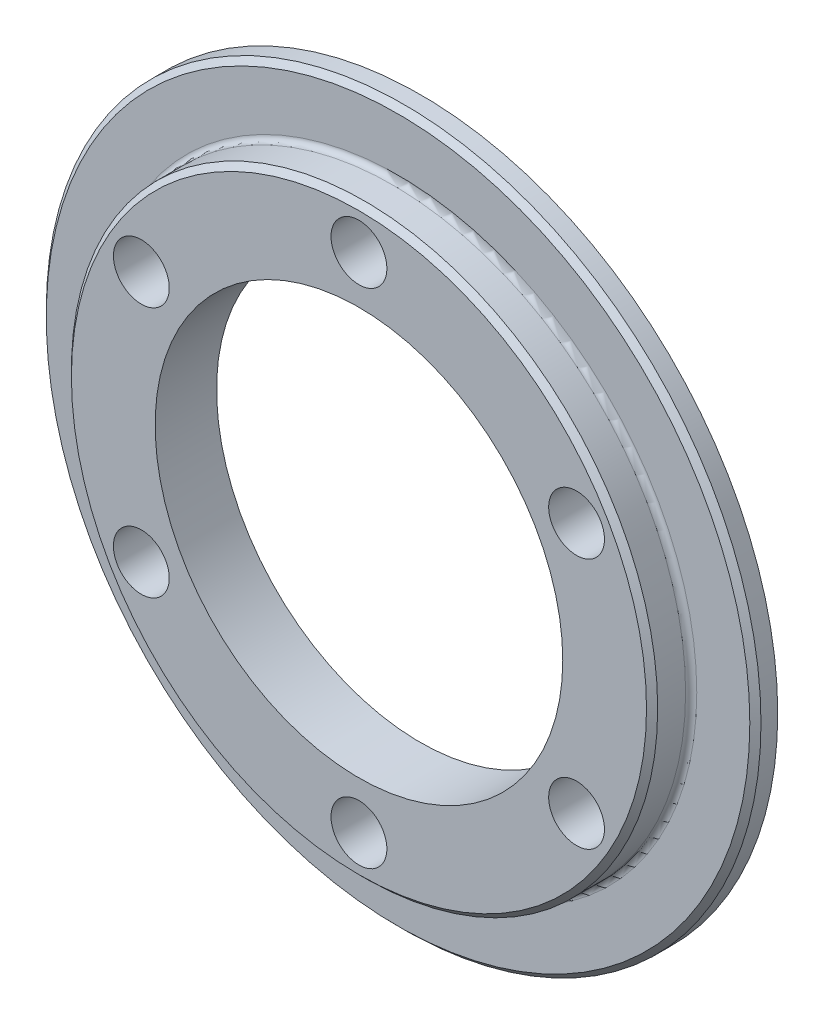
from build123d import *

# Parameters (mm, degrees)
IZIM1_R                     = 64
IZIM1_R_2                   = 36.5
Y_KSEKLIK_EKSTR_ZYON1_DEPTH = 11
IZIM2_R                     = 79.958425649
IZIM2_R_2                   = 52.5
KES_EKSTR_ZYON1_DEPTH       = 7
RADYUS1_R                   = 1
PAH1_SIZE                   = 1
IZIM3_R                     = 5
KES_EKSTR_ZYON2_DEPTH       = 60


with BuildPart() as part:
    # Çizim1 → Yükseklik-Ekstrüzyon1 (new body)
    with BuildSketch(Plane.XY):
        Circle(IZIM1_R)
        Circle(IZIM1_R_2, mode=Mode.SUBTRACT)
    extrude(amount=Y_KSEKLIK_EKSTR_ZYON1_DEPTH)

    # Çizim2 → Kes-Ekstrüzyon1 (cut)
    with BuildSketch(Plane.XY.offset(11)):
        Circle(IZIM2_R)
        Circle(IZIM2_R_2, mode=Mode.SUBTRACT)
    extrude(amount=-KES_EKSTR_ZYON1_DEPTH, mode=Mode.SUBTRACT)

    # Radyus1
    radyus1_edges = [part.edges().sort_by_distance(p)[0] for p in [
        (-52.5, 0, 4),
    ]]
    fillet(radyus1_edges, radius=RADYUS1_R)

    # Pah1
    pah1_edges = [part.edges().sort_by_distance(p)[0] for p in [
        (-64, 0, 4),
        (-52.5, 0, 11),
    ]]
    chamfer(pah1_edges, length=PAH1_SIZE)

    # Çizim3 → Kes-Ekstrüzyon2 (cut)
    with BuildSketch(Plane(origin=(0, 0, 0), x_dir=(-1, 0, 0), z_dir=(0, 0, -1))):
        with Locations((0, 45)):
            Circle(IZIM3_R)
        with Locations((38.97114317, 22.5)):
            Circle(IZIM3_R)
        with Locations((38.97114317, -22.5)):
            Circle(IZIM3_R)
        with Locations((0, -45)):
            Circle(IZIM3_R)
        with Locations((-38.97114317, -22.5)):
            Circle(IZIM3_R)
        with Locations((-38.97114317, 22.5)):
            Circle(IZIM3_R)
    extrude(amount=-KES_EKSTR_ZYON2_DEPTH, mode=Mode.SUBTRACT)


solid = part.part
